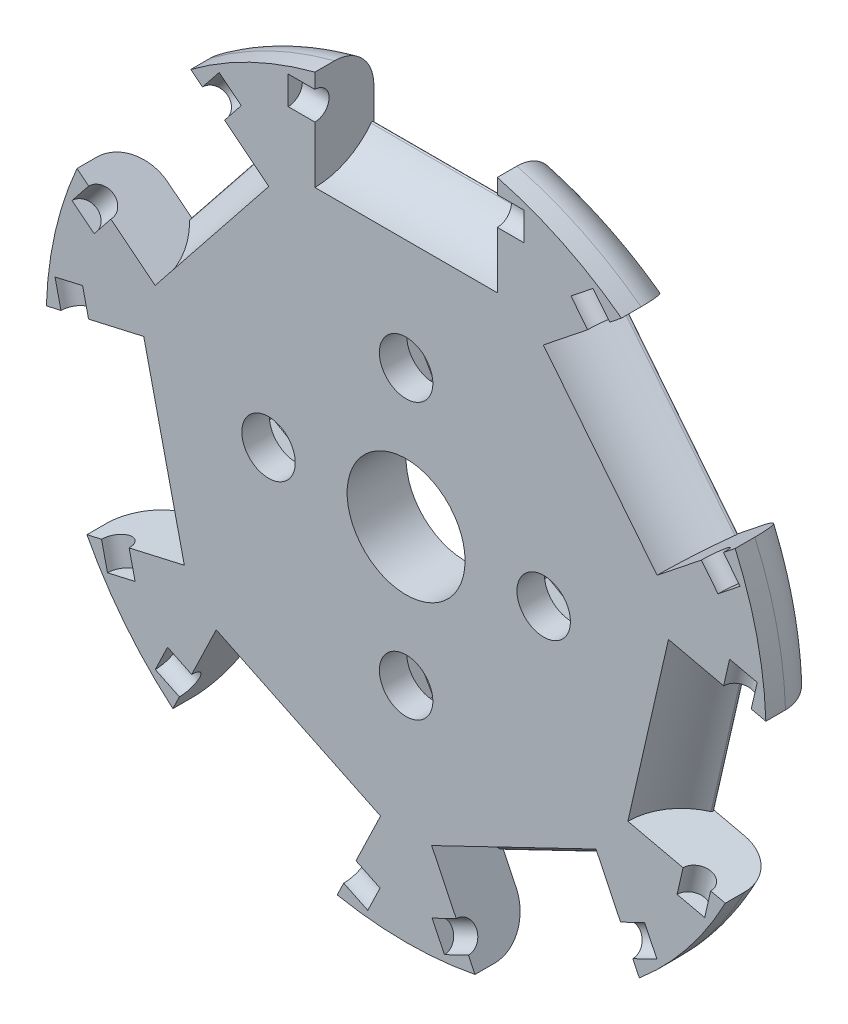
from build123d import *

# Parameters (mm, degrees)
SKETCH1_R                = 29.0703
BOSS_EXTRUDE2_DEPTH      = 4.7625
FILLET1_R                = 3.175
SKETCH2_W                = 14.732
SKETCH2_H                = 10.414
CUT_EXTRUDE2_DEPTH       = 12.7
CIRPATTERN1_COUNT        = 7
SKETCH4_R                = 1.143
CUT_EXTRUDE4_DEPTH       = 9.525
CIRPATTERN2_COUNT        = 7
SKETCH6_R                = 2.159
CUT_EXTRUDE7_DEPTH       = 42.376236281
BOSS_EXTRUDE4_REACH      = 48.843
FILLET2_R                = 0.127
CIRPATTERN5_COUNT        = 7
FILLET2_OF_CIRPATTERN5_R = 0.127
CUT_EXTRUDE9_REACH       = 43.376
SKETCH5_R                = 4.7625
CUT_EXTRUDE8_DEPTH       = 42.376236281
CUT_EXTRUDE8_DEPTH_BACK  = 2.54


with BuildPart() as part:
    # Sketch1 → Boss-Extrude2 (new body)
    with BuildSketch(Plane.XY):
        Circle(SKETCH1_R)
    extrude(amount=-BOSS_EXTRUDE2_DEPTH)

    # Fillet1
    fillet1_edges = [part.edges().sort_by_distance(p)[0] for p in [
        (-29.0703, 0, -4.7625),
    ]]
    fillet(fillet1_edges, radius=FILLET1_R)

    # Sketch2 → Cut-Extrude2 (cut)
    with BuildSketch(Plane.XY):
        with Locations((0, 25.1333)):
            Rectangle(SKETCH2_W, SKETCH2_H)
    cut_extrude2 = extrude(amount=-CUT_EXTRUDE2_DEPTH, mode=Mode.SUBTRACT)

    # CirPattern1: Cut-Extrude2 ×7 about axis
    cirpattern1_axis = Axis((0, 0, 0), (0, 0, 1))
    for i in range(1, CIRPATTERN1_COUNT):
        add(cut_extrude2.rotate(cirpattern1_axis, i * 360 / CIRPATTERN1_COUNT), mode=Mode.SUBTRACT)

    # Sketch4 → Cut-Extrude4 (cut, symmetric)
    with BuildSketch(Plane(origin=(0, 0, 0), x_dir=(0, 0, -1), z_dir=(1, 0, 0))):
        with Locations((0, 25.7683)):
            Circle(SKETCH4_R)
    cut_extrude4 = extrude(amount=CUT_EXTRUDE4_DEPTH, both=True, mode=Mode.SUBTRACT)

    # CirPattern2: Cut-Extrude4 ×7 about axis
    cirpattern2_axis = Axis((0, 0, 0), (0, 0, 1))
    for i in range(1, CIRPATTERN2_COUNT):
        add(cut_extrude4.rotate(cirpattern2_axis, i * 360 / CIRPATTERN2_COUNT), mode=Mode.SUBTRACT)

    # Sketch6 → Cut-Extrude7 (cut, through all)
    with BuildSketch(Plane(origin=(0, 0, -4.7625), x_dir=(-1, 0, 0), z_dir=(0, 0, -1))):
        with Locations((11.1125, 0)):
            Circle(SKETCH6_R)
        with Locations((0, -11.1125)):
            Circle(SKETCH6_R)
        with Locations((-11.1125, 0)):
            Circle(SKETCH6_R)
        with Locations((0, 11.1125)):
            Circle(SKETCH6_R)
    extrude(amount=-CUT_EXTRUDE7_DEPTH, mode=Mode.SUBTRACT)

    # Sketch10 → Boss-Extrude4 (add, up to next)
    with BuildSketch(Plane.ZY.offset(-7.366), mode=Mode.PRIVATE) as boss_extrude4_sk1:
        with BuildLine():
            Line((-4.7625, 19.9263), (0, 19.9263))
            Line((0, 19.9263), (0, 20.0533))
            ThreePointArc((0, 20.0533), (-2.7025038, 20.73265722), (-4.7625, 22.609214887))
            Line((-4.7625, 22.609214887), (-4.7625, 19.9263))
        make_face()
    boss_extrude4_tool1 = extrude(boss_extrude4_sk1.sketch, amount=BOSS_EXTRUDE4_REACH, mode=Mode.PRIVATE) - part.part
    boss_extrude4 = boss_extrude4_tool1.solids().sort_by_distance((7.366, 20.664807, -3.452063))[0]
    add(boss_extrude4)

    # Fillet2
    fillet2_edges = [part.edges().sort_by_distance(p)[0] for p in [
        (0, 22.609214887, -4.7625),
    ]]
    fillet(fillet2_edges, radius=FILLET2_R)

    # CirPattern5: Boss-Extrude4 ×7 about axis
    cirpattern5_axis = Axis((0, 0, 0), (0, 0, 1))
    for i in range(1, CIRPATTERN5_COUNT):
        add(boss_extrude4.rotate(cirpattern5_axis, i * 360 / CIRPATTERN5_COUNT))

    # Fillet2 of CirPattern5
    fillet2_of_cirpattern5_edges = [part.edges().sort_by_distance(p)[0] for p in [
        (-17.676595993, 14.09661491, -4.7625),
        (-22.042354666, -5.031023613, -4.7625),
        (-9.809770694, -20.370198741, -4.7625),
        (9.809770694, -20.370198741, -4.7625),
        (22.042354666, -5.031023613, -4.7625),
        (17.676595993, 14.09661491, -4.7625),
    ]]
    fillet(fillet2_of_cirpattern5_edges, radius=FILLET2_OF_CIRPATTERN5_R)

    # Sketch5 → Cut-Extrude9 (cut, up to next)
    with BuildSketch(Plane.XY, mode=Mode.PRIVATE) as cut_extrude9_sk1:
        Circle(SKETCH5_R)
    cut_extrude9_tool1 = extrude(cut_extrude9_sk1.sketch, amount=-CUT_EXTRUDE9_REACH, mode=Mode.PRIVATE) & part.part
    add(cut_extrude9_tool1.solids().sort_by_distance((0, 0, 0))[0], mode=Mode.SUBTRACT)

    # Sketch7 → Cut-Extrude8 (cut, two sides: drawn at the far end of the back side and taken through both)
    with BuildSketch(Plane(origin=(0, 0, -4.7625), x_dir=(-1, 0, 0), z_dir=(0, 0, -1)).offset(-CUT_EXTRUDE8_DEPTH_BACK)):
        Polygon((15.5575, -2.566321947), (15.5575, 2.566321947), (11.1125, 5.132643893), (6.6675, 2.566321947), (6.6675, -2.566321947), (11.1125, -5.132643893), align=None)
        Polygon((2.566321947, 15.5575), (-2.566321947, 15.5575), (-5.132643893, 11.1125), (-2.566321947, 6.6675), (2.566321947, 6.6675), (5.132643893, 11.1125), align=None)
        Polygon((-2.566321947, -15.5575), (2.566321947, -15.5575), (5.132643893, -11.1125), (2.566321947, -6.6675), (-2.566321947, -6.6675), (-5.132643893, -11.1125), align=None)
        Polygon((-15.5575, 2.566321947), (-15.5575, -2.566321947), (-11.1125, -5.132643893), (-6.6675, -2.566321947), (-6.6675, 2.566321947), (-11.1125, 5.132643893), align=None)
    extrude(amount=CUT_EXTRUDE8_DEPTH + CUT_EXTRUDE8_DEPTH_BACK, mode=Mode.SUBTRACT)


solid = part.part
